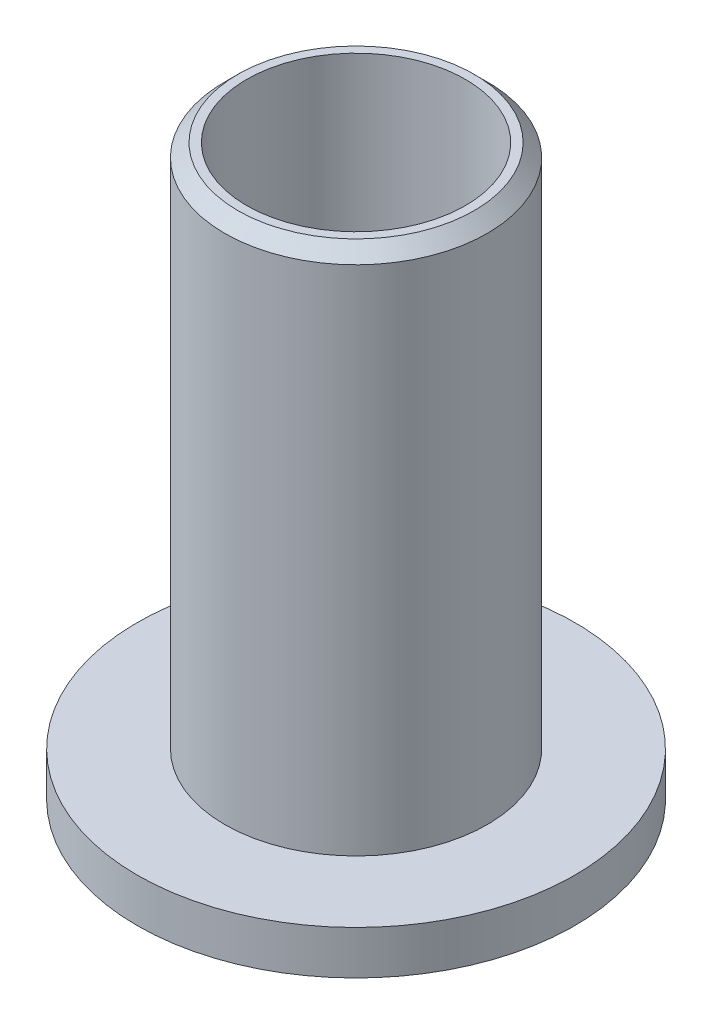
from build123d import *

# Parameters (mm, degrees)
SKETCH1_R               = 5
BOSS_EXTRUDE1_DEPTH     = 1
SKETCH2_R               = 3
BOSS_EXTRUDE2_DEPTH     = 12
CHAMFER1_SIZE           = 0.3
CUT_EXTRUDE1_DEPTH      = 15.798648587
CUT_EXTRUDE1_DEPTH_BACK = 15.798648587
SKETCH3_R               = 2.5


with BuildPart() as part:
    # Sketch1 → Boss-Extrude1 (new body)
    with BuildSketch(Plane(origin=(0, 0, 0), x_dir=(1, 0, 0), z_dir=(0, 1, 0))):
        with Locations(Location((0, 0, 0), (0, 0, 270))):
            Circle(SKETCH1_R)
    extrude(amount=BOSS_EXTRUDE1_DEPTH)

    # Sketch2 → Boss-Extrude2 (add)
    with BuildSketch(Plane(origin=(0, 1, 0), x_dir=(1, 0, 0), z_dir=(0, 1, 0))):
        with Locations(Location((0, 0, 0), (0, 0, 270))):
            Circle(SKETCH2_R)
    extrude(amount=BOSS_EXTRUDE2_DEPTH)

    # Chamfer1
    chamfer1_edges = [part.edges().sort_by_distance(p)[0] for p in [
        (0, 13, -3),
    ]]
    chamfer(chamfer1_edges, length=CHAMFER1_SIZE)

    # Sketch3 → Cut-Extrude1 (cut, two sides: drawn at the far end of the back side and taken through both)
    with BuildSketch(Plane(origin=(0, 13, 0), x_dir=(1, 0, 0), z_dir=(0, 1, 0)).offset(-CUT_EXTRUDE1_DEPTH_BACK)):
        with Locations(Location((0, 0, 0), (0, 0, 270))):
            Circle(SKETCH3_R)
    extrude(amount=CUT_EXTRUDE1_DEPTH + CUT_EXTRUDE1_DEPTH_BACK, mode=Mode.SUBTRACT)


solid = part.part
